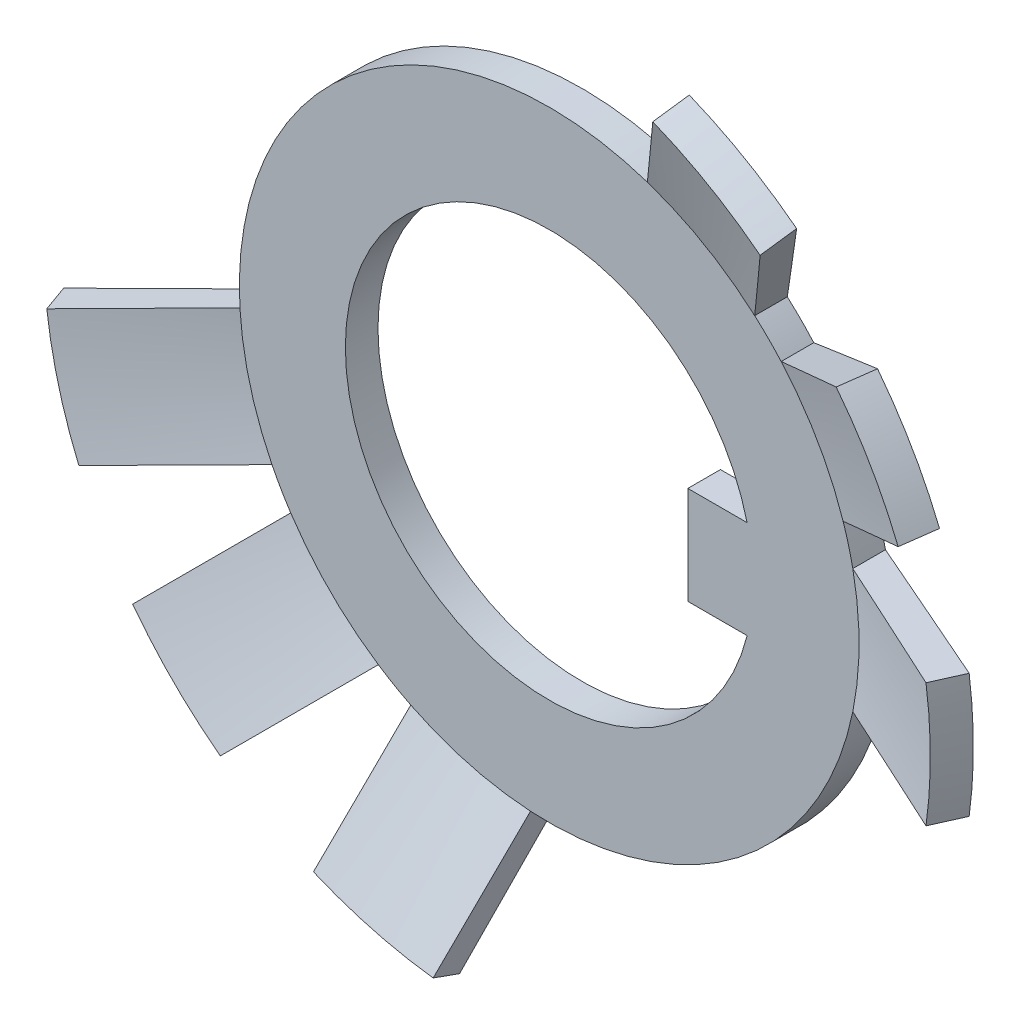
from build123d import *

# Parameters (mm, degrees)
SKETCH2_OUTSIDE_W = 37.94
SKETCH2_OUTSIDE_H = 37.94
CUT_EXTRUDE_DEPTH = 23.420400339


with BuildPart() as part:
    # Sketch1 → Base-Extrude (revolve)
    with BuildSketch(Plane.YZ, mode=Mode.PRIVATE) as base_extrude_sk:
        Polygon((0, -2.909378314), (-9.5, -2.909378314), (-14, -0.91417266), (-13.594675009, 0), (-9.5, -1.909378314), (0, -1.909378314), align=None)
    revolve(base_extrude_sk.sketch.rotate(Axis((0, 0, 5.823648763), (0, 0, -1)), 270), axis=Axis((0, 0, 5.823648763), (0, 0, -1)))

    # Sketch2 outside → Cut-Extrude (cut, through all)
    # profile 1 of 2: a face of its own
    with BuildSketch(Plane(origin=(-2.40435344, 1.003568156, -2.909378314), x_dir=(-1, 0, 0), z_dir=(0, 0, -1))):
        with Locations((-2.404, -1.004)):
            Rectangle(SKETCH2_OUTSIDE_W, SKETCH2_OUTSIDE_H)
        with BuildLine():
            Line((-11.712414462, -2.903568156), (-16.274825674, -2.903568156))
            ThreePointArc((-16.274825674, -2.903568156), (-16.40435344, -1.003568156), (-16.274825674, 0.896431844))
            Line((-16.274825674, 0.896431844), (-11.712414462, 0.896431844))
            ThreePointArc((-11.712414462, 0.896431844), (-11.580648789, 1.455212772), (-11.415370745, 2.005014088))
            Line((-11.415370745, 2.005014088), (-15.366534757, 4.286219694))
            ThreePointArc((-15.366534757, 4.286219694), (-14.528709093, 5.996431844), (-13.466534757, 7.577116228))
            Line((-13.466534757, 7.577116228), (-9.515370745, 5.295910622))
            ThreePointArc((-9.515370745, 5.295910622), (-9.121867861, 5.713946265), (-8.703832218, 6.107449149))
            Line((-8.703832218, 6.107449149), (-10.985037824, 10.058613161))
            ThreePointArc((-10.985037824, 10.058613161), (-9.40435344, 11.120787497), (-7.69414129, 11.958613161))
            Line((-7.69414129, 11.958613161), (-5.412935684, 8.007449149))
            ThreePointArc((-5.412935684, 8.007449149), (3.378880136, 6.533288576), (7.07829928, -1.577412552))
            Line((7.07829928, -1.577412552), (11.4852501, -2.758251465))
            ThreePointArc((11.4852501, -2.758251465), (11.118608128, -4.627034788), (10.501737729, -6.428769605))
            Line((10.501737729, -6.428769605), (6.094786909, -5.247930692))
            ThreePointArc((6.094786909, -5.247930692), (5.822887896, -5.753568156), (5.520942513, -6.241858341))
            Line((5.520942513, -6.241858341), (8.74705442, -9.467970247))
            ThreePointArc((8.74705442, -9.467970247), (7.495141497, -10.903063093), (6.060048651, -12.154976016))
            Line((6.060048651, -12.154976016), (2.833936745, -8.928864109))
            ThreePointArc((2.833936745, -8.928864109), (2.34564656, -9.230809492), (1.840009096, -9.502708505))
            Line((1.840009096, -9.502708505), (3.020848009, -13.909659325))
            ThreePointArc((3.020848009, -13.909659325), (1.219113192, -14.526529724), (-0.649670131, -14.893171696))
            Line((-0.649670131, -14.893171696), (-1.830509044, -10.486220876))
            ThreePointArc((-1.830509044, -10.486220876), (-8.187587015, -8.540424889), (-11.712414462, -2.903568156))
        make_face(mode=Mode.SUBTRACT)
    # profile 2 of 2: a face of its own
    with BuildSketch(Plane(origin=(-2.40435344, 1.003568156, -2.909378314), x_dir=(-1, 0, 0), z_dir=(0, 0, -1))):
        with BuildLine():
            Line((-8.471683989, 0.496431844), (-6.65435344, 0.496431844))
            Line((-6.65435344, 0.496431844), (-6.65435344, -2.503568156))
            Line((-6.65435344, -2.503568156), (-8.471683989, -2.503568156))
            ThreePointArc((-8.471683989, -2.503568156), (3.84564656, -1.003568156), (-8.471683989, 0.496431844))
        make_face()
    extrude(amount=-CUT_EXTRUDE_DEPTH, mode=Mode.SUBTRACT)


solid = part.part
